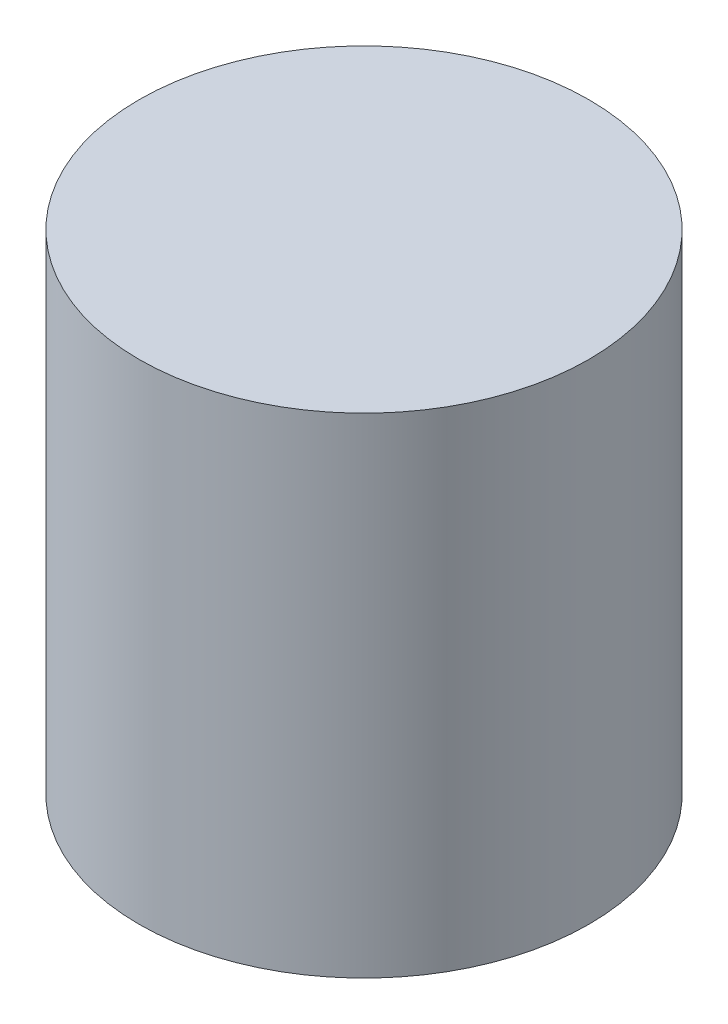
from build123d import *

# Parameters (mm, degrees)
SKETCH1_R           = 2
BOSS_EXTRUDE1_DEPTH = 4.35


with BuildPart() as part:
    # Sketch1 → Boss-Extrude1 (new body)
    with BuildSketch(Plane(origin=(0, 0, 0), x_dir=(1, 0, 0), z_dir=(0, 1, 0))):
        with Locations(Location((0, 0, 0), (0, 0, 270))):
            Circle(SKETCH1_R)
    extrude(amount=BOSS_EXTRUDE1_DEPTH)


solid = part.part
